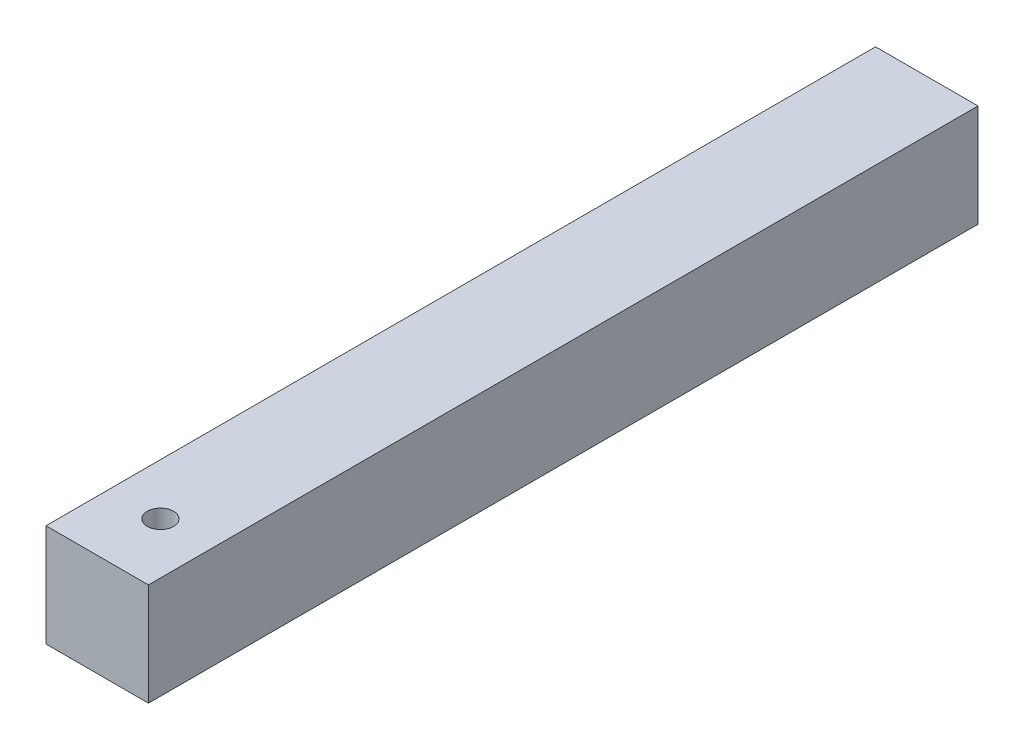
from build123d import *

# Parameters (mm, degrees)
SKETCH1_W           = 24.7
SKETCH1_H           = 24.7
BOSS_EXTRUDE1_DEPTH = 200
SKETCH1_4_W         = 12
SKETCH1_4_H         = 12
CUT_EXTRUDE1_DEPTH  = 193.65
SKETCH2_R           = 3.175
CUT_EXTRUDE2_DEPTH  = 203.353187521


with BuildPart() as part:
    # Sketch1 → Boss-Extrude1 (new body)
    with BuildSketch(Plane.XY):
        with Locations((6, 6)):
            Rectangle(SKETCH1_W, SKETCH1_H)
    extrude(amount=BOSS_EXTRUDE1_DEPTH)

    # Sketch1<4> → Cut-Extrude1 (cut)
    with BuildSketch(Plane.XY):
        with Locations((6, 6)):
            Rectangle(SKETCH1_4_W, SKETCH1_4_H)
    extrude(amount=CUT_EXTRUDE1_DEPTH, mode=Mode.SUBTRACT)

    # Sketch2 → Cut-Extrude2 (cut, through all)
    with BuildSketch(Plane(origin=(0, 18.35, 0), x_dir=(1, 0, 0), z_dir=(0, 1, 0))):
        with Locations(Location((6, -184.76, 0), (0, 0, 270))):
            Circle(SKETCH2_R)
    extrude(amount=-CUT_EXTRUDE2_DEPTH, mode=Mode.SUBTRACT)


solid = part.part
